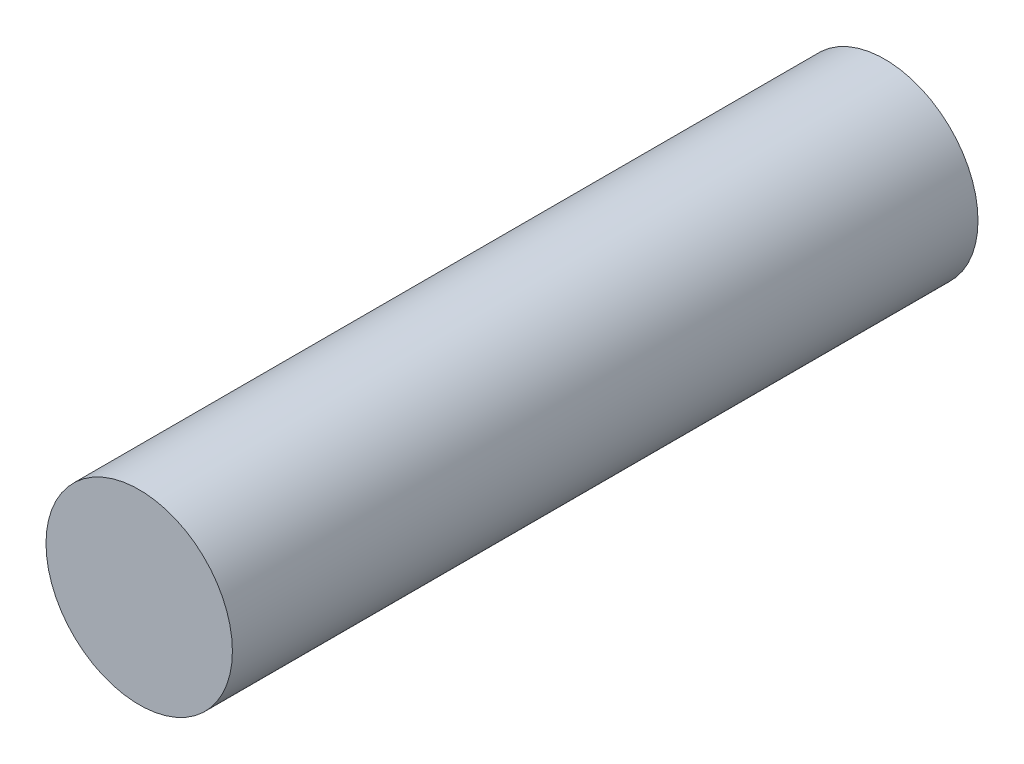
from build123d import *

# Parameters (mm, degrees)
ESQUISSE1_R        = 1.5
BOSS_EXTRU_1_DEPTH = 12


with BuildPart() as part:
    # Esquisse1 → Boss.-Extru.1 (new body)
    with BuildSketch(Plane.XY):
        Circle(ESQUISSE1_R)
    extrude(amount=BOSS_EXTRU_1_DEPTH)


solid = part.part
